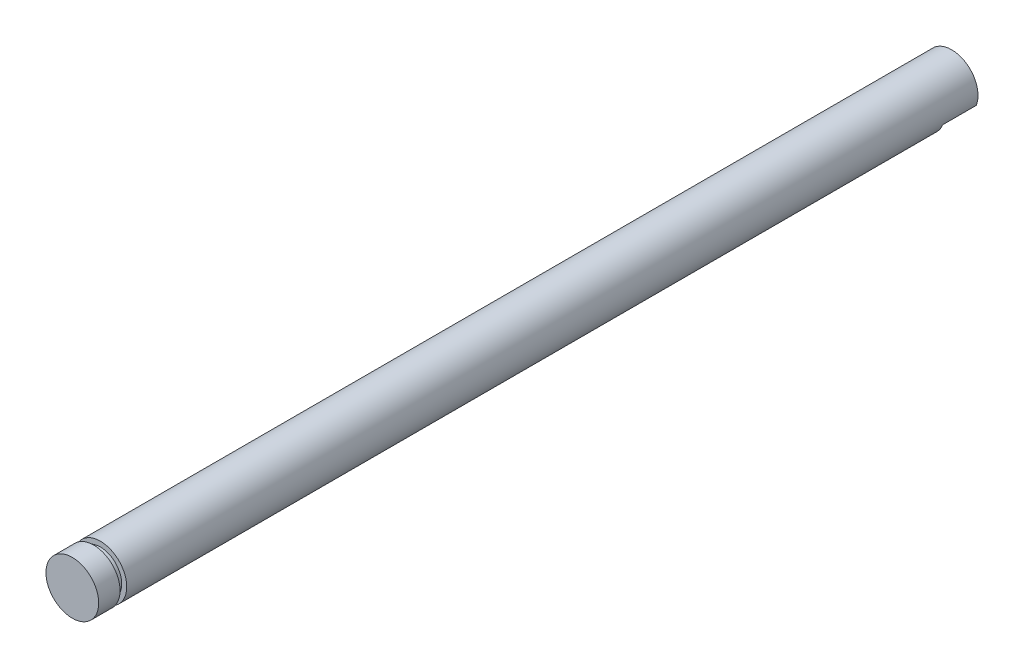
from build123d import *

# Parameters (mm, degrees)
SKETCH1_R               = 2
BOSS_EXTRUDE1_DEPTH     = 33.3375
SKETCH2_W               = 0.508
SKETCH2_H               = 0.381
CUT_EXTRUDE1_DEPTH      = 34.457269856
CUT_EXTRUDE1_DEPTH_BACK = 34.457269856
SKETCH3_W               = 2.54
SKETCH3_H               = 1.27


with BuildPart() as part:
    # Sketch1 → Boss-Extrude1 (new, symmetric)
    with BuildSketch(Plane.XY):
        Circle(SKETCH1_R)
    extrude(amount=BOSS_EXTRUDE1_DEPTH, both=True)

    # Sketch2 → Cut-Revolve1 (revolve, cut)
    with BuildSketch(Plane(origin=(0, 0, 0), x_dir=(0, 0, -1), z_dir=(1, 0, 0)), mode=Mode.PRIVATE) as cut_revolve1_sk:
        with Locations((-31.46425, 1.8095)):
            Rectangle(SKETCH2_W, SKETCH2_H)
    revolve(cut_revolve1_sk.sketch.rotate(Axis((0, 0, 33.3375), (0, 0, -1)), 90), axis=Axis((0, 0, 33.3375), (0, 0, -1)), mode=Mode.SUBTRACT)

    # Sketch3 → Cut-Extrude1 (cut, two sides: drawn at the far end of the back side and taken through both)
    with BuildSketch(Plane(origin=(0, 0, 0), x_dir=(0, 0, -1), z_dir=(1, 0, 0)).offset(-CUT_EXTRUDE1_DEPTH_BACK)):
        with Locations((32.0675, -1.365)):
            Rectangle(SKETCH3_W, SKETCH3_H)
    extrude(amount=CUT_EXTRUDE1_DEPTH + CUT_EXTRUDE1_DEPTH_BACK, mode=Mode.SUBTRACT)


solid = part.part
